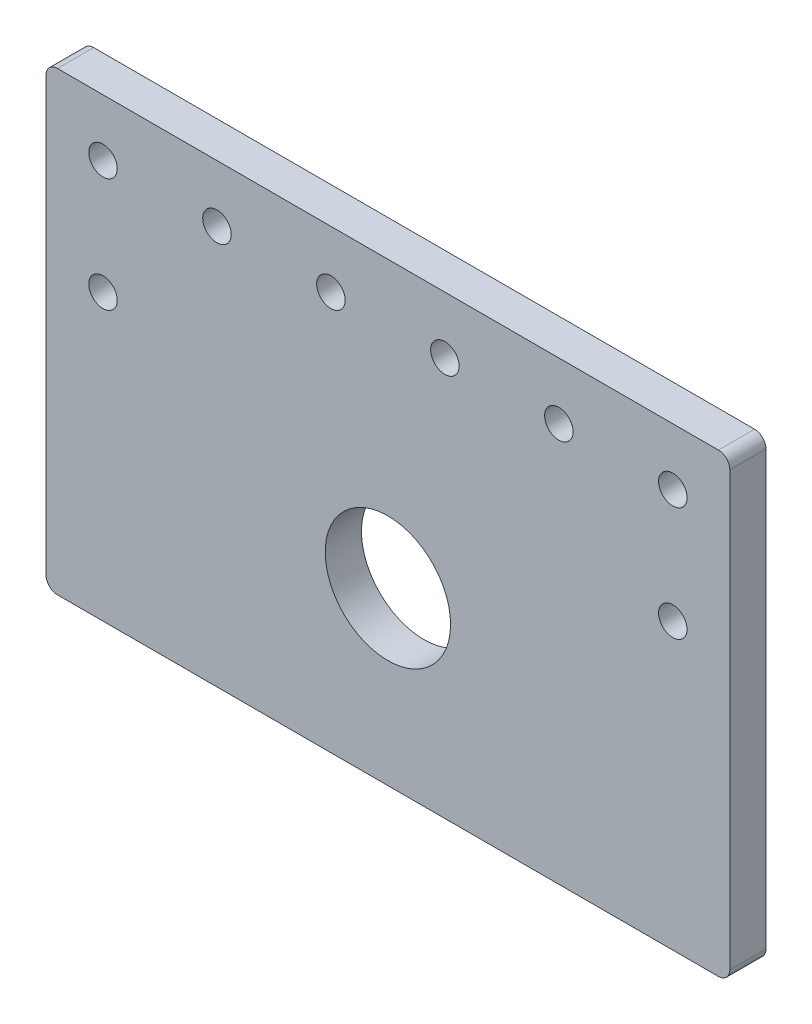
from build123d import *

# Parameters (mm, degrees)
SKETCH1_W           = 120
SKETCH1_H           = 80
SKETCH1_R           = 2.5
SKETCH1_R_2         = 11
BOSS_EXTRUDE1_DEPTH = 6.35
FILLET1_R           = 2


with BuildPart() as part:
    # Sketch1 → Boss-Extrude1 (new body)
    with BuildSketch(Plane.XY):
        Rectangle(SKETCH1_W, SKETCH1_H)
        with Locations((-50, 30)):
            Circle(SKETCH1_R, mode=Mode.SUBTRACT)
        with Locations((-30, 30)):
            Circle(SKETCH1_R, mode=Mode.SUBTRACT)
        with Locations((-10, 30)):
            Circle(SKETCH1_R, mode=Mode.SUBTRACT)
        with Locations((10, 30)):
            Circle(SKETCH1_R, mode=Mode.SUBTRACT)
        with Locations((30, 30)):
            Circle(SKETCH1_R, mode=Mode.SUBTRACT)
        with Locations((50, 30)):
            Circle(SKETCH1_R, mode=Mode.SUBTRACT)
        with Locations((-50, 10)):
            Circle(SKETCH1_R, mode=Mode.SUBTRACT)
        with Locations((50, 10)):
            Circle(SKETCH1_R, mode=Mode.SUBTRACT)
        with Locations((0, -10)):
            Circle(SKETCH1_R_2, mode=Mode.SUBTRACT)
    extrude(amount=BOSS_EXTRUDE1_DEPTH)

    # Fillet1
    fillet1_edges = [part.edges().sort_by_distance(p)[0] for p in [
        (60, -40, 3.175),
        (-60, -40, 3.175),
        (-60, 40, 3.175),
        (60, 40, 3.175),
    ]]
    fillet(fillet1_edges, radius=FILLET1_R)


solid = part.part
